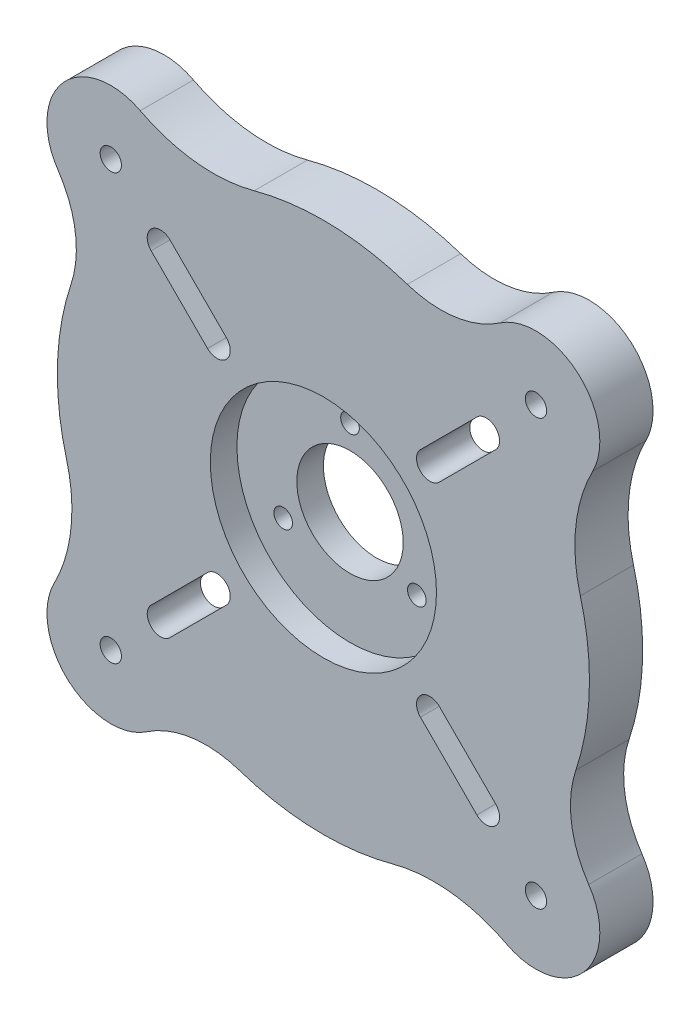
from build123d import *

# Parameters (mm, degrees)
SKETCH2_R           = 2
BOSS_EXTRUDE1_DEPTH = 10
SKETCH3_R           = 21.25
SKETCH3_R_2         = 1.75
SKETCH3_R_3         = 10
CUT_EXTRUDE1_DEPTH  = 5
SKETCH3_2_R         = 1.75
CUT_EXTRUDE2_DEPTH  = 75.1479844
SKETCH3_3_R         = 10
CUT_EXTRUDE3_DEPTH  = 75.1479844


with BuildPart() as part:
    # Sketch2 → Boss-Extrude1 (new body)
    with BuildSketch(Plane.XY):
        with BuildLine():
            ThreePointArc((47.439646086, -15.794935239), (49.978651673, -1.460950691), (48.281273579, 12.996869684))
            ThreePointArc((48.281273579, 12.996869684), (47.432136683, 23.927789331), (50.602299686, 34.423317157))
            ThreePointArc((50.602299686, 34.423317157), (47.913811427, 48.929401728), (33.190424757, 49.865534018))
            ThreePointArc((33.190424757, 49.865534018), (24.776660442, 46.616230999), (15.794935239, 47.439646086))
            ThreePointArc((15.794935239, 47.439646086), (1.460950691, 49.978651673), (-12.996869684, 48.281273579))
            ThreePointArc((-12.996869684, 48.281273579), (-23.927789331, 47.432136683), (-34.423317157, 50.602299686))
            ThreePointArc((-34.423317157, 50.602299686), (-48.929401728, 47.913811427), (-49.865534018, 33.190424757))
            ThreePointArc((-49.865534018, 33.190424757), (-46.616230999, 24.776660442), (-47.439646086, 15.794935239))
            ThreePointArc((-47.439646086, 15.794935239), (-49.978651673, 1.460950691), (-48.281273579, -12.996869684))
            ThreePointArc((-48.281273579, -12.996869684), (-47.432136683, -23.927789331), (-50.602299686, -34.423317157))
            ThreePointArc((-50.602299686, -34.423317157), (-47.913811427, -48.929401728), (-33.190424757, -49.865534018))
            ThreePointArc((-33.190424757, -49.865534018), (-24.776660442, -46.616230999), (-15.794935239, -47.439646086))
            ThreePointArc((-15.794935239, -47.439646086), (-1.460950691, -49.978651673), (12.996869684, -48.281273579))
            ThreePointArc((12.996869684, -48.281273579), (23.927789331, -47.432136683), (34.423317157, -50.602299686))
            ThreePointArc((34.423317157, -50.602299686), (48.929401728, -47.913811427), (49.865534018, -33.190424757))
            ThreePointArc((49.865534018, -33.190424757), (46.616230999, -24.776660442), (47.439646086, -15.794935239))
        make_face()
        with BuildLine():
            ThreePointArc((-28.838834765, -32.374368671), (-32.374368671, -32.374368671), (-32.374368671, -28.838834765))
            Line((-32.374368671, -28.838834765), (-21.767766953, -18.232233047))
            ThreePointArc((-21.767766953, -18.232233047), (-18.232233047, -18.232233047), (-18.232233047, -21.767766953))
            Line((-18.232233047, -21.767766953), (-28.838834765, -32.374368671))
        make_face(mode=Mode.SUBTRACT)
        with BuildLine():
            ThreePointArc((32.374368671, -28.838834765), (32.374368671, -32.374368671), (28.838834765, -32.374368671))
            Line((28.838834765, -32.374368671), (18.232233047, -21.767766953))
            ThreePointArc((18.232233047, -21.767766953), (18.232233047, -18.232233047), (21.767766953, -18.232233047))
            Line((21.767766953, -18.232233047), (32.374368671, -28.838834765))
        make_face(mode=Mode.SUBTRACT)
        with BuildLine():
            ThreePointArc((-32.374368671, 28.838834765), (-32.374368671, 32.374368671), (-28.838834765, 32.374368671))
            Line((-28.838834765, 32.374368671), (-18.232233047, 21.767766953))
            ThreePointArc((-18.232233047, 21.767766953), (-18.232233047, 18.232233047), (-21.767766953, 18.232233047))
            Line((-21.767766953, 18.232233047), (-32.374368671, 28.838834765))
        make_face(mode=Mode.SUBTRACT)
        with BuildLine():
            ThreePointArc((28.838834765, 32.374368671), (32.374368671, 32.374368671), (32.374368671, 28.838834765))
            Line((32.374368671, 28.838834765), (21.767766953, 18.232233047))
            ThreePointArc((21.767766953, 18.232233047), (18.232233047, 18.232233047), (18.232233047, 21.767766953))
            Line((18.232233047, 21.767766953), (28.838834765, 32.374368671))
        make_face(mode=Mode.SUBTRACT)
        with Locations((39.951533137, -39.951533137)):
            Circle(SKETCH2_R, mode=Mode.SUBTRACT)
        with Locations((-39.951533137, -39.951533137)):
            Circle(SKETCH2_R, mode=Mode.SUBTRACT)
        with Locations((-39.951533137, 39.951533137)):
            Circle(SKETCH2_R, mode=Mode.SUBTRACT)
        with Locations((39.951533137, 39.951533137)):
            Circle(SKETCH2_R, mode=Mode.SUBTRACT)
    extrude(amount=BOSS_EXTRUDE1_DEPTH)

    # Sketch3 → Cut-Extrude1 (cut)
    with BuildSketch(Plane.XY.offset(10)):
        Circle(SKETCH3_R)
        with Locations((0, 14.5)):
            Circle(SKETCH3_R_2, mode=Mode.SUBTRACT)
        with Locations((12.557368355, -7.25)):
            Circle(SKETCH3_R_2, mode=Mode.SUBTRACT)
        with Locations((-12.557368355, -7.25)):
            Circle(SKETCH3_R_2, mode=Mode.SUBTRACT)
        Circle(SKETCH3_R_3, mode=Mode.SUBTRACT)
    extrude(amount=-CUT_EXTRUDE1_DEPTH, mode=Mode.SUBTRACT)

    # Sketch3<2> → Cut-Extrude2 (cut, through all)
    with BuildSketch(Plane.XY.offset(10)):
        with Locations((0, 14.5)):
            Circle(SKETCH3_2_R)
        with Locations((12.557368355, -7.25)):
            Circle(SKETCH3_2_R)
        with Locations((-12.557368355, -7.25)):
            Circle(SKETCH3_2_R)
    extrude(amount=-CUT_EXTRUDE2_DEPTH, mode=Mode.SUBTRACT)

    # Sketch3<3> → Cut-Extrude3 (cut, through all)
    with BuildSketch(Plane.XY.offset(10)):
        Circle(SKETCH3_3_R)
    extrude(amount=-CUT_EXTRUDE3_DEPTH, mode=Mode.SUBTRACT)


solid = part.part
